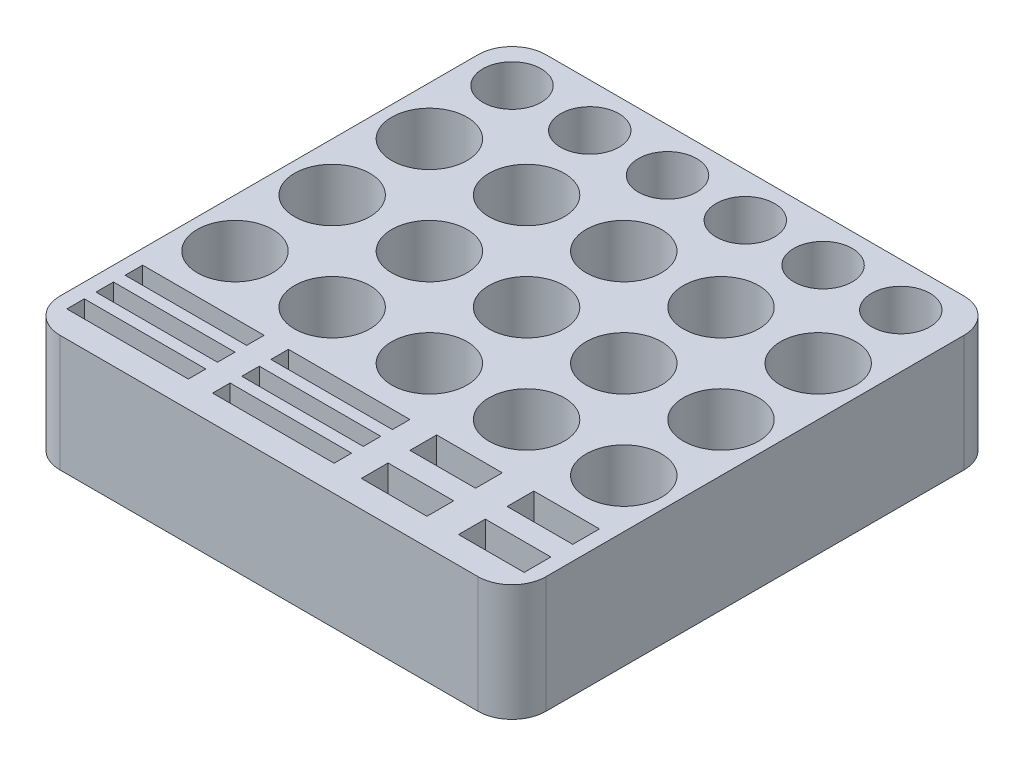
from build123d import *

# Parameters (mm, degrees)
SKETCH1_W           = 100
SKETCH1_H           = 100
BOSS_EXTRUDE1_DEPTH = 24
SKETCH2_R           = 6
SKETCH2_R_2         = 7.75
SKETCH2_W           = 25
SKETCH2_H           = 3.6
SKETCH2_W_2         = 13.5
SKETCH2_H_2         = 5.5
CUT_EXTRUDE1_DEPTH  = 22
FILLET1_R           = 7


with BuildPart() as part:
    # Sketch1 → Boss-Extrude1 (new body)
    with BuildSketch(Plane(origin=(0, 0, 0), x_dir=(1, 0, 0), z_dir=(0, 1, 0))):
        Rectangle(SKETCH1_W, SKETCH1_H)
    extrude(amount=BOSS_EXTRUDE1_DEPTH)

    # Sketch2 → Cut-Extrude1 (cut)
    with BuildSketch(Plane(origin=(0, 24, 0), x_dir=(1, 0, 0), z_dir=(0, 1, 0))):
        with Locations(Location((-41, 41, 0), (0, 0, 270))):
            Circle(SKETCH2_R)
        with Locations(Location((-25, 41, 0), (0, 0, 270))):
            Circle(SKETCH2_R)
        with Locations(Location((-9, 41, 0), (0, 0, 270))):
            Circle(SKETCH2_R)
        with Locations(Location((7, 41, 0), (0, 0, 270))):
            Circle(SKETCH2_R)
        with Locations(Location((23, 41, 0), (0, 0, 270))):
            Circle(SKETCH2_R)
        with Locations(Location((39, 41, 0), (0, 0, 270))):
            Circle(SKETCH2_R)
        with Locations(Location((-40, 23, 0), (0, 0, 270))):
            Circle(SKETCH2_R_2)
        with Locations(Location((-20, 23, 0), (0, 0, 270))):
            Circle(SKETCH2_R_2)
        with Locations(Location((0, 23, 0), (0, 0, 270))):
            Circle(SKETCH2_R_2)
        with Locations(Location((20, 23, 0), (0, 0, 270))):
            Circle(SKETCH2_R_2)
        with Locations(Location((40, 23, 0), (0, 0, 270))):
            Circle(SKETCH2_R_2)
        with Locations(Location((-20, 3, 0), (0, 0, 270))):
            Circle(SKETCH2_R_2)
        with Locations(Location((0, 3, 0), (0, 0, 270))):
            Circle(SKETCH2_R_2)
        with Locations(Location((20, 3, 0), (0, 0, 270))):
            Circle(SKETCH2_R_2)
        with Locations(Location((40, 3, 0), (0, 0, 270))):
            Circle(SKETCH2_R_2)
        with Locations(Location((-20, -17, 0), (0, 0, 270))):
            Circle(SKETCH2_R_2)
        with Locations(Location((0, -17, 0), (0, 0, 270))):
            Circle(SKETCH2_R_2)
        with Locations(Location((20, -17, 0), (0, 0, 270))):
            Circle(SKETCH2_R_2)
        with Locations(Location((40, -17, 0), (0, 0, 270))):
            Circle(SKETCH2_R_2)
        with Locations(Location((-40, 3, 0), (0, 0, 270))):
            Circle(SKETCH2_R_2)
        with Locations(Location((-40, -17, 0), (0, 0, 270))):
            Circle(SKETCH2_R_2)
        with Locations((-4.5, -30.8)):
            Rectangle(SKETCH2_W, SKETCH2_H)
        with Locations((-34.5, -30.8)):
            Rectangle(SKETCH2_W, SKETCH2_H)
        with Locations((-4.5, -36.8)):
            Rectangle(SKETCH2_W, SKETCH2_H)
        with Locations((-4.5, -42.8)):
            Rectangle(SKETCH2_W, SKETCH2_H)
        with Locations((-34.5, -36.8)):
            Rectangle(SKETCH2_W, SKETCH2_H)
        with Locations((-34.5, -42.8)):
            Rectangle(SKETCH2_W, SKETCH2_H)
        with Locations((20.25, -31.75)):
            Rectangle(SKETCH2_W_2, SKETCH2_H_2)
        with Locations((40.25, -31.75)):
            Rectangle(SKETCH2_W_2, SKETCH2_H_2)
        with Locations((20.25, -41.75)):
            Rectangle(SKETCH2_W_2, SKETCH2_H_2)
        with Locations((40.25, -41.75)):
            Rectangle(SKETCH2_W_2, SKETCH2_H_2)
    extrude(amount=-CUT_EXTRUDE1_DEPTH, mode=Mode.SUBTRACT)

    # Fillet1
    fillet1_edges = [part.edges().sort_by_distance(p)[0] for p in [
        (50, 12, 50),
        (-50, 12, 50),
        (-50, 12, -50),
        (50, 12, -50),
    ]]
    fillet(fillet1_edges, radius=FILLET1_R)


solid = part.part
